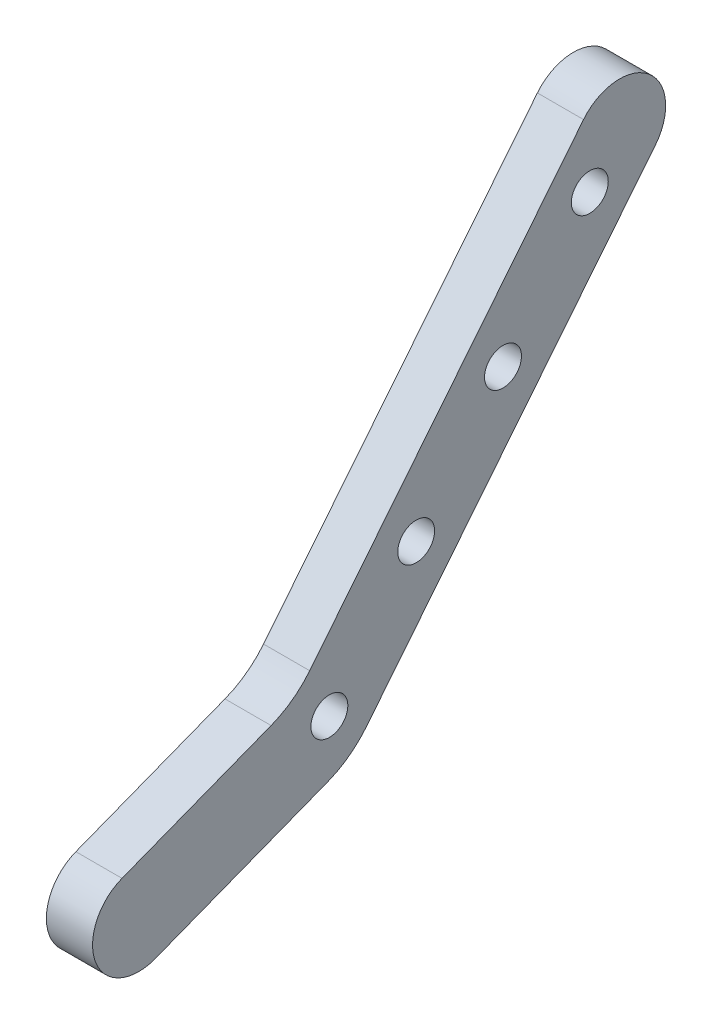
from build123d import *

# Parameters (mm, degrees)
BOSS_EXTRUDE1_DEPTH = 5
SKETCH2_R           = 2
CUT_EXTRUDE1_DEPTH  = 5
FILLET1_R           = 10
FILLET2_R           = 10


with BuildPart() as part:
    # Sketch1 → Boss-Extrude1 (new body)
    with BuildSketch(Plane(origin=(0, 0, 0), x_dir=(0, 0, -1), z_dir=(1, 0, 0))):
        with BuildLine():
            Line((3.89561725, -3.134352603), (36.078990527, 36.865647397))
            ThreePointArc((36.078990527, 36.865647397), (35.317725879, 43.89561725), (28.287756026, 43.134352603))
            Line((28.287756026, 43.134352603), (-3.055770002, 4.178180099))
            Line((-3.055770002, 4.178180099), (-21.704720416, -3.047928704))
            ThreePointArc((-21.704720416, -3.047928704), (-24.560430819, -9.516693509), (-18.091666014, -12.372403912))
            Line((-18.091666014, -12.372403912), (1.806527201, -4.662237604))
            Line((1.806527201, -4.662237604), (3.055770002, -4.178180099))
            Line((3.055770002, -4.178180099), (3.89561725, -3.134352603))
        make_face()
    extrude(amount=BOSS_EXTRUDE1_DEPTH)

    # Sketch2 → Cut-Extrude1 (cut)
    with BuildSketch(Plane(origin=(5, 0, 0), x_dir=(0, 0, -1), z_dir=(1, 0, 0))):
        with Locations((28.965035949, 36)):
            Circle(SKETCH2_R)
        with Locations((19.561978141, 24.313148249)):
            Circle(SKETCH2_R)
        with Locations((10.158920332, 12.626296498)):
            Circle(SKETCH2_R)
        with Locations((0.755862524, 0.939444747)):
            Circle(SKETCH2_R)
    extrude(amount=-CUT_EXTRUDE1_DEPTH, mode=Mode.SUBTRACT)

    # Fillet1
    fillet1_edges = [part.edges().sort_by_distance(p)[0] for p in [
        (2.5, 4.178180099, 3.055770002),
    ]]
    fillet(fillet1_edges, radius=FILLET1_R)

    # Fillet2
    fillet2_edges = [part.edges().sort_by_distance(p)[0] for p in [
        (2.5, -4.178180099, -3.055770002),
    ]]
    fillet(fillet2_edges, radius=FILLET2_R)


solid = part.part
